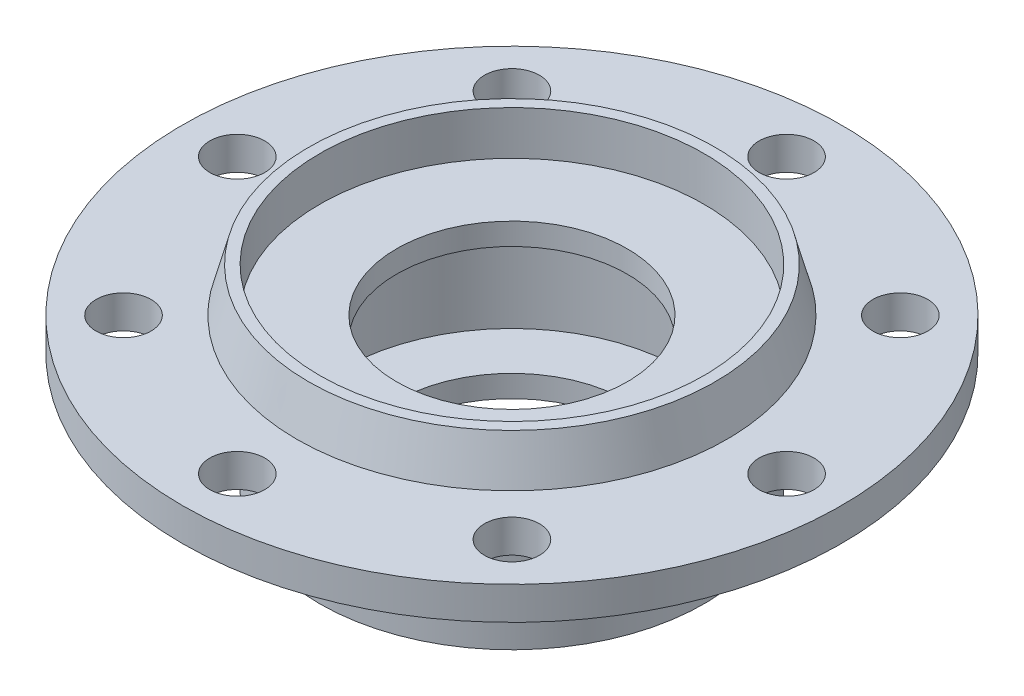
from build123d import *

# Parameters (mm, degrees)
SKETCH3_R          = 5
CUT_EXTRUDE1_DEPTH = 10


with BuildPart() as part:
    # Sketch2 → Revolve1 (revolve)
    with BuildSketch(Plane.XY, mode=Mode.PRIVATE) as revolve1_sk:
        Polygon((-47.527918782, 29.515656182), (-37.527918782, 29.515656182), (-37.527918782, 49.515656182), (-47.527918782, 49.515656182), (-47.527918782, 53.515656182), (-33.527918782, 53.515656182), (-33.527918782, 61.515656182), (-31.527918782, 61.515656182), (-29.384325242, 53.515656182), (-8.527918782, 53.515656182), (-8.527918782, 47.515656182), (-33.527918782, 47.515656182), (-33.527918782, 27.427572824), (-33.527918782, 25.515656182), (-47.527918782, 25.515656182), align=None)
    revolve(revolve1_sk.sketch.rotate(Axis((-68.527918782, 64.847715736, 0), (0, -1, 0)), 90), axis=Axis((-68.527918782, 64.847715736, 0), (0, -1, 0)))

    # Sketch3 → Cut-Extrude1 (cut)
    with BuildSketch(Plane(origin=(0, 53.515656182, 0), x_dir=(1, 0, 0), z_dir=(0, 1, 0))):
        with Locations(Location((-118.527918782, 0, 0), (0, 0, 270))):
            Circle(SKETCH3_R)
        with Locations(Location((-103.883257841, 35.355339059, 0), (0, 0, 270))):
            Circle(SKETCH3_R)
        with Locations(Location((-68.527918782, 50, 0), (0, 0, 270))):
            Circle(SKETCH3_R)
        with Locations(Location((-33.172579722, 35.355339059, 0), (0, 0, 270))):
            Circle(SKETCH3_R)
        with Locations(Location((-18.527918782, 0, 0), (0, 0, 270))):
            Circle(SKETCH3_R)
        with Locations(Location((-33.172579722, -35.355339059, 0), (0, 0, 270))):
            Circle(SKETCH3_R)
        with Locations(Location((-68.527918782, -50, 0), (0, 0, 270))):
            Circle(SKETCH3_R)
        with Locations(Location((-103.883257841, -35.355339059, 0), (0, 0, 270))):
            Circle(SKETCH3_R)
    extrude(amount=-CUT_EXTRUDE1_DEPTH, mode=Mode.SUBTRACT)


solid = part.part
